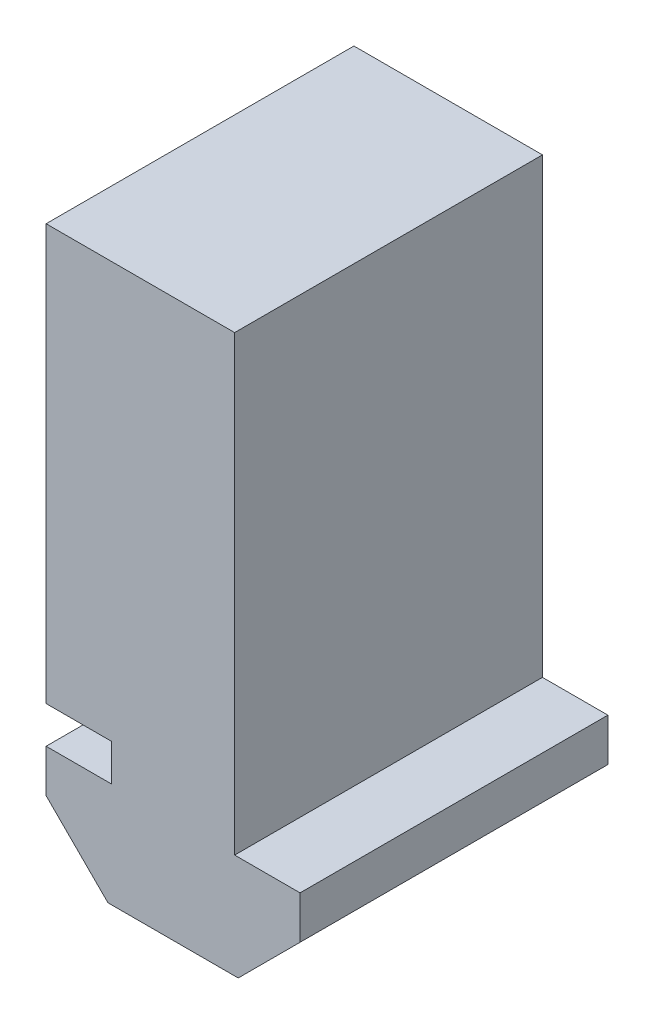
from build123d import *

# Parameters (mm, degrees)
ESTRUSIONE_ESTRUSIONE1_DEPTH = 20


with BuildPart() as part:
    # Schizzo2 → Estrusione-Estrusione1 (new body)
    with BuildSketch(Plane.XY):
        Polygon((-4, 9.2), (-8.25, 9.2), (-8.25, 36.2), (4, 36.2), (4, 9.2), (4, 6.8), (8.25, 6.8), (8.25, 4.017766953), (4.232233047, 0), (-4.232233047, 0), (-8.25, 4.017766953), (-8.25, 6.8), (-4, 6.8), align=None)
    extrude(amount=-ESTRUSIONE_ESTRUSIONE1_DEPTH)


solid = part.part
